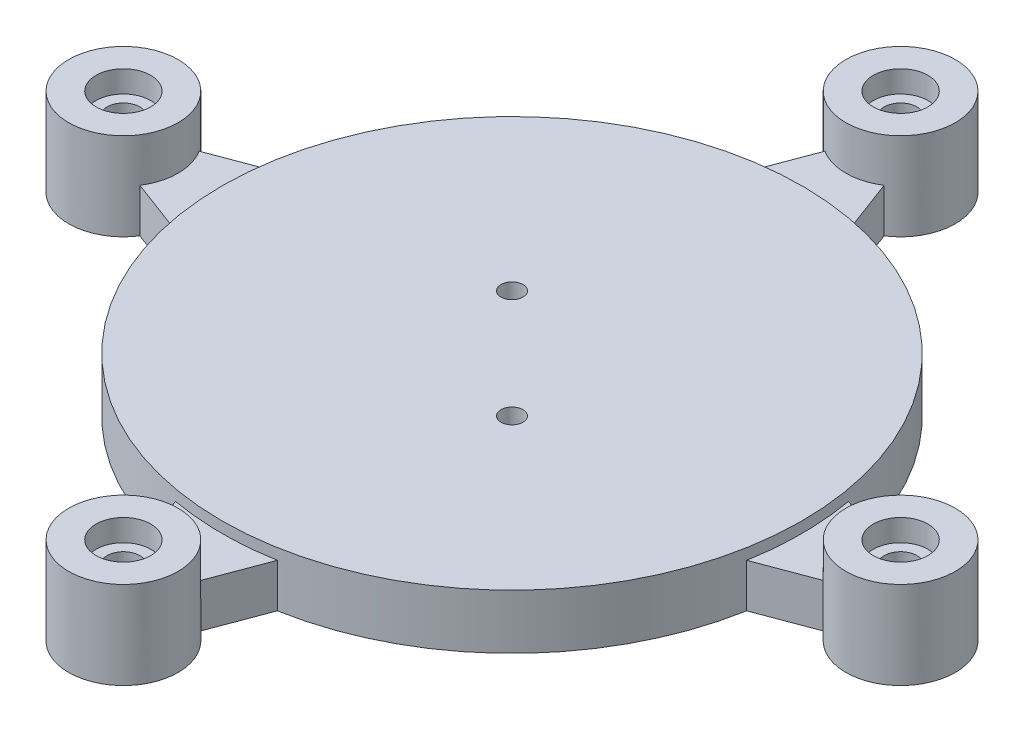
from build123d import *

# Parameters (mm, degrees)
CROQUIS1_R              = 26.5
SALIENTE_EXTRUIR1_DEPTH = 5
SALIENTE_EXTRUIR2_DEPTH = 4
CROQUIS3_R              = 5
SALIENTE_EXTRUIR3_DEPTH = 4
CROQUIS4_R              = 2.5
CORTAR_EXTRUIR1_DEPTH   = 2
CROQUIS5_R              = 1.5
CORTAR_EXTRUIR2_DEPTH   = 49.769867746
MATRIZC1_COUNT          = 4
CROQUIS6_R              = 1
CORTAR_EXTRUIR3_DEPTH   = 58.493477891


with BuildPart() as part:
    # Croquis1 → Saliente-Extruir1 (new body)
    with BuildSketch(Plane(origin=(0, 0, 0), x_dir=(1, 0, 0), z_dir=(0, 1, 0))):
        with Locations(Location((0, 0, 0), (0, 0, 270))):
            Circle(CROQUIS1_R)
    extrude(amount=SALIENTE_EXTRUIR1_DEPTH)

    # Croquis2 → Saliente-Extruir2 (add)
    with BuildSketch(Plane(origin=(0, 0, 0), x_dir=(1, 0, 0), z_dir=(0, 1, 0))):
        with BuildLine():
            Line((-5.029139679, 25.088960855), (-2.702516138, 31.293290297))
            ThreePointArc((-2.702516138, 31.293290297), (0, 40.5), (2.702516138, 31.293290297))
            Line((2.702516138, 31.293290297), (5.029139679, 25.088960855))
            Line((5.029139679, 25.088960855), (-5.029139679, 25.088960855))
        make_face()
    saliente_extruir2 = extrude(amount=SALIENTE_EXTRUIR2_DEPTH)

    # Croquis3 → Saliente-Extruir3 (add)
    with BuildSketch(Plane(origin=(0, 4, 0), x_dir=(1, 0, 0), z_dir=(0, 1, 0))):
        with Locations(Location((0, 35.5, 0), (0, 0, 237.282097692))):
            Circle(CROQUIS3_R)
    saliente_extruir3 = extrude(amount=SALIENTE_EXTRUIR3_DEPTH)

    # Croquis4 → Cortar-Extruir1 (cut)
    with BuildSketch(Plane(origin=(0, 8, 0), x_dir=(1, 0, 0), z_dir=(0, 1, 0))):
        with Locations(Location((0, 35.5, 0), (0, 0, 270))):
            Circle(CROQUIS4_R)
    cortar_extruir1 = extrude(amount=-CORTAR_EXTRUIR1_DEPTH, mode=Mode.SUBTRACT)

    # Croquis5 → Cortar-Extruir2 (cut, through all)
    with BuildSketch(Plane(origin=(0, 6, 0), x_dir=(1, 0, 0), z_dir=(0, 1, 0))):
        with Locations(Location((0, 35.5, 0), (0, 0, 270))):
            Circle(CROQUIS5_R)
    cortar_extruir2 = extrude(amount=-CORTAR_EXTRUIR2_DEPTH, mode=Mode.SUBTRACT)

    # MatrizC1: Saliente-Extruir2, Saliente-Extruir3, Cortar-Extruir1, Cortar-Extruir2 ×4 about axis
    matrizc1_axis = Axis((0, 0, 0), (0, 1, 0))
    add([saliente_extruir2.rotate(matrizc1_axis, i * 360 / MATRIZC1_COUNT) for i in range(1, MATRIZC1_COUNT)])
    add([saliente_extruir3.rotate(matrizc1_axis, i * 360 / MATRIZC1_COUNT) for i in range(1, MATRIZC1_COUNT)])
    add([cortar_extruir1.rotate(matrizc1_axis, i * 360 / MATRIZC1_COUNT) for i in range(1, MATRIZC1_COUNT)], mode=Mode.SUBTRACT)
    add([cortar_extruir2.rotate(matrizc1_axis, i * 360 / MATRIZC1_COUNT) for i in range(1, MATRIZC1_COUNT)], mode=Mode.SUBTRACT)

    # Croquis6 → Cortar-Extruir3 (cut, through all)
    with BuildSketch(Plane(origin=(0, 5, 0), x_dir=(1, 0, 0), z_dir=(0, 1, 0))):
        with Locations(Location((-4.949747468, 4.949747468, 0), (0, 0, 270))):
            Circle(CROQUIS6_R)
        with Locations(Location((4.949747468, -4.949747468, 0), (0, 0, 270))):
            Circle(CROQUIS6_R)
    extrude(amount=-CORTAR_EXTRUIR3_DEPTH, mode=Mode.SUBTRACT)


solid = part.part
